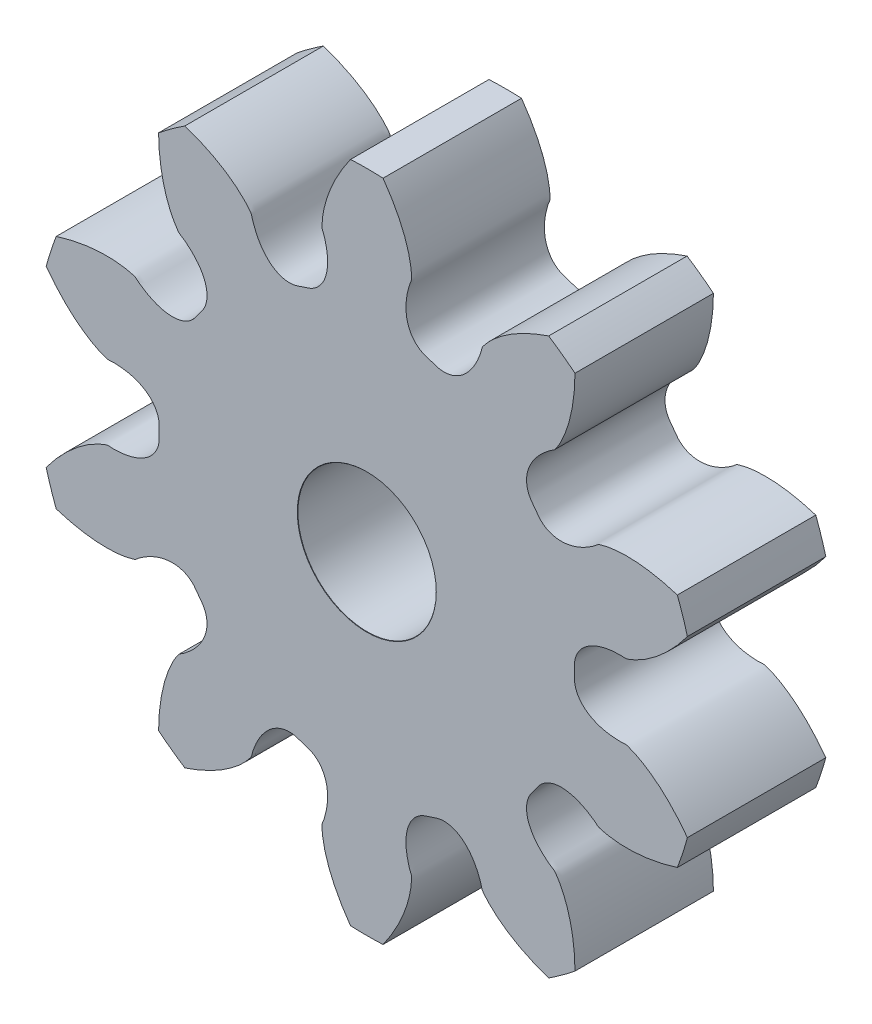
from build123d import *

# Parameters (mm, degrees)
SKETCHREVOLVESPUR01_W       = 5
SKETCHREVOLVESPUR01_H       = 11.99999982
TOOTHEXTRUDECUTSPUR01_DEPTH = 2.5
PATTERNSPUR01_COUNT         = 10


with BuildPart() as part:
    # SketchRevolveSpur01 → Spur01 (revolve)
    with BuildSketch(Plane(origin=(0, 0, 0), x_dir=(0, 0, -1), z_dir=(1, 0, 0))):
        with Locations((0, 5.99999991)):
            Rectangle(SKETCHREVOLVESPUR01_W, SKETCHREVOLVESPUR01_H)
    revolve(axis=Axis((0, 0, 0), (0, 0, -1)))

    # SketchToothSpur01 → ToothExtrudeCutSpur01 (cut, symmetric)
    with BuildSketch(Plane.XY):
        with BuildLine():
            ThreePointArc((11.655653982, 3.248957658), (12.099999818, 0), (11.655653982, -3.248957658))
            add(Edge.make_bspline(
                [(11.655653982, -3.248957658), (11.542287726, -3.089305996), (11.367738762, -2.862436555), (11.123534782, -2.583010481), (10.947999265, -2.397865834), (10.776192053, -2.230764528), (10.609269419, -2.081082218), (10.44834245, -1.948131117), (10.294473867, -1.831161756), (10.148674628, -1.729370493), (10.011902198, -1.641886679), (9.885053932, -1.567827248), (9.768976882, -1.506134891), (9.664426294, -1.45610176), (9.572183953, -1.415767403), (9.474218443, -1.379996288), (9.351476065, -1.328641113), (9.21414192, -1.355832051), (9.089686, -1.350996807), (8.991189949, -1.347769188), (8.895083812, -1.340387735), (8.801254328, -1.330142809), (8.709751295, -1.316726231), (8.620575928, -1.300229256), (8.533736646, -1.280620754), (8.449236025, -1.257878982), (8.367076474, -1.231952957), (8.287262228, -1.202767588), (8.209803923, -1.170216951), (8.134724742, -1.134160443), (8.062069108, -1.094418466), (7.991914548, -1.050769425), (7.924387429, -1.002949027), (7.859683092, -0.950653937), (7.798090337, -0.893552503), (7.740018842, -0.831306192), (7.686026832, -0.763605636), (7.636840194, -0.690224751), (7.593362614, -0.611092562), (7.55662796, -0.526379885), (7.527823561, -0.436575845), (7.507840639, -0.342571173), (7.499499015, -0.256553159), (7.496355153, -0.142125776), (7.502676626, 0), (7.496355153, 0.142125776), (7.499499015, 0.256553159), (7.507840639, 0.342571173), (7.527823561, 0.436575845), (7.55662796, 0.526379885), (7.593362614, 0.611092562), (7.636840194, 0.690224751), (7.686026832, 0.763605636), (7.740018842, 0.831306192), (7.798090337, 0.893552503), (7.859683092, 0.950653937), (7.924387429, 1.002949027), (7.991914548, 1.050769425), (8.062069108, 1.094418466), (8.134724742, 1.134160443), (8.209803923, 1.170216951), (8.287262228, 1.202767588), (8.367076474, 1.231952957), (8.449236025, 1.257878982), (8.533736646, 1.280620754), (8.620575928, 1.300229256), (8.709751295, 1.316726231), (8.801254328, 1.330142809), (8.895083812, 1.340387735), (8.991189949, 1.347769188), (9.089686, 1.350996807), (9.21414192, 1.355832051), (9.351476065, 1.328641113), (9.474218443, 1.379996288), (9.572183953, 1.415767403), (9.664426294, 1.45610176), (9.768976882, 1.506134891), (9.885053932, 1.567827248), (10.011902198, 1.641886679), (10.148674628, 1.729370493), (10.294473867, 1.831161756), (10.44834245, 1.948131117), (10.609269419, 2.081082218), (10.776192053, 2.230764528), (10.947999265, 2.397865834), (11.123534782, 2.583010481), (11.367738762, 2.862436555), (11.542287726, 3.089305996), (11.655653982, 3.248957658)],
                knots=[0, 0, 0, 0, 0.051709588, 0.075523214, 0.097976061, 0.11906813, 0.138799421, 0.157169932, 0.174179665, 0.18982862, 0.204116796, 0.217044194, 0.228610813, 0.238816653, 0.247661716, 0.255145999, 0.266488168, 0.281932497, 0.29079109, 0.29945754, 0.3079389, 0.316243077, 0.32437896, 0.33235655, 0.340187113, 0.347883348, 0.355459572, 0.362931907, 0.370318475, 0.377639574, 0.384917807, 0.392178142, 0.399447816, 0.40675603, 0.414133302, 0.42161038, 0.429216569, 0.436977418, 0.444911792, 0.453028613, 0.461323803, 0.469778278, 0.478357898, 0.484105769, 0.5, 0.515894231, 0.521642102, 0.530221722, 0.538676197, 0.546971387, 0.555088208, 0.563022582, 0.570783431, 0.57838962, 0.585866698, 0.59324397, 0.600552184, 0.607821858, 0.615082193, 0.622360426, 0.629681525, 0.637068093, 0.644540428, 0.652116652, 0.659812887, 0.66764345, 0.67562104, 0.683756923, 0.6920611, 0.70054246, 0.70920891, 0.718067503, 0.733511832, 0.744854001, 0.752338284, 0.761183347, 0.771389187, 0.782955806, 0.795883204, 0.81017138, 0.825820335, 0.842830068, 0.861200579, 0.88093187, 0.902023939, 0.924476786, 0.948290412, 1, 1, 1, 1], degree=3))
        make_face()
    toothextrudecutspur01 = extrude(amount=TOOTHEXTRUDECUTSPUR01_DEPTH, both=True, mode=Mode.SUBTRACT)

    # PatternSpur01: ToothExtrudeCutSpur01 ×10 about axis
    patternspur01_axis = Axis((0, 0, 55), (0, 0, -1))
    for i in range(1, PATTERNSPUR01_COUNT):
        add(toothextrudecutspur01.rotate(patternspur01_axis, i * 360 / PATTERNSPUR01_COUNT), mode=Mode.SUBTRACT)

    # BoreRevolveSketch → BoreRevolveCut (revolve, cut)
    with BuildSketch(Plane(origin=(0, 0, 0), x_dir=(0, 0, -1), z_dir=(1, 0, 0))):
        Polygon((-2.5, 0), (2.5, 0), (2.5, 2.51), (2.49, 2.5), (-2.49, 2.5), (-2.5, 2.51), align=None)
    revolve(axis=Axis((0, 0, 0), (0, 0, -1)), mode=Mode.SUBTRACT)


solid = part.part
